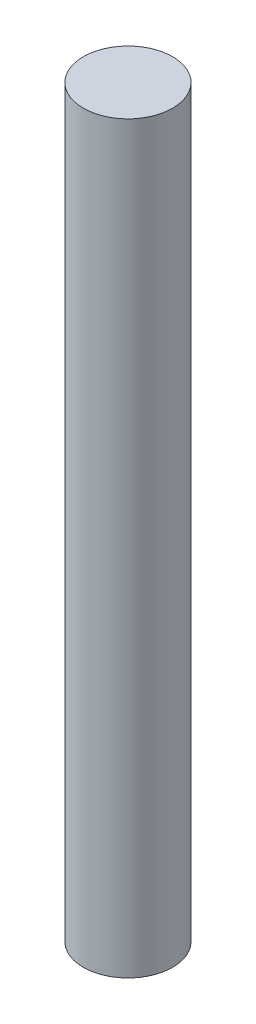
from build123d import *

# Parameters (mm, degrees)
SKETCH_1_R      = 0.6
EXTRUDE_1_DEPTH = 10


with BuildPart() as part:
    # 草图1 → 凸台-拉伸1 (new body)
    with BuildSketch(Plane(origin=(0, 0, 0), x_dir=(1, 0, 0), z_dir=(0, 1, 0))):
        with Locations(Location((-3.13988528, -1.623404019, 0), (0, 0, 270))):
            Circle(SKETCH_1_R)
    extrude(amount=EXTRUDE_1_DEPTH)


solid = part.part
